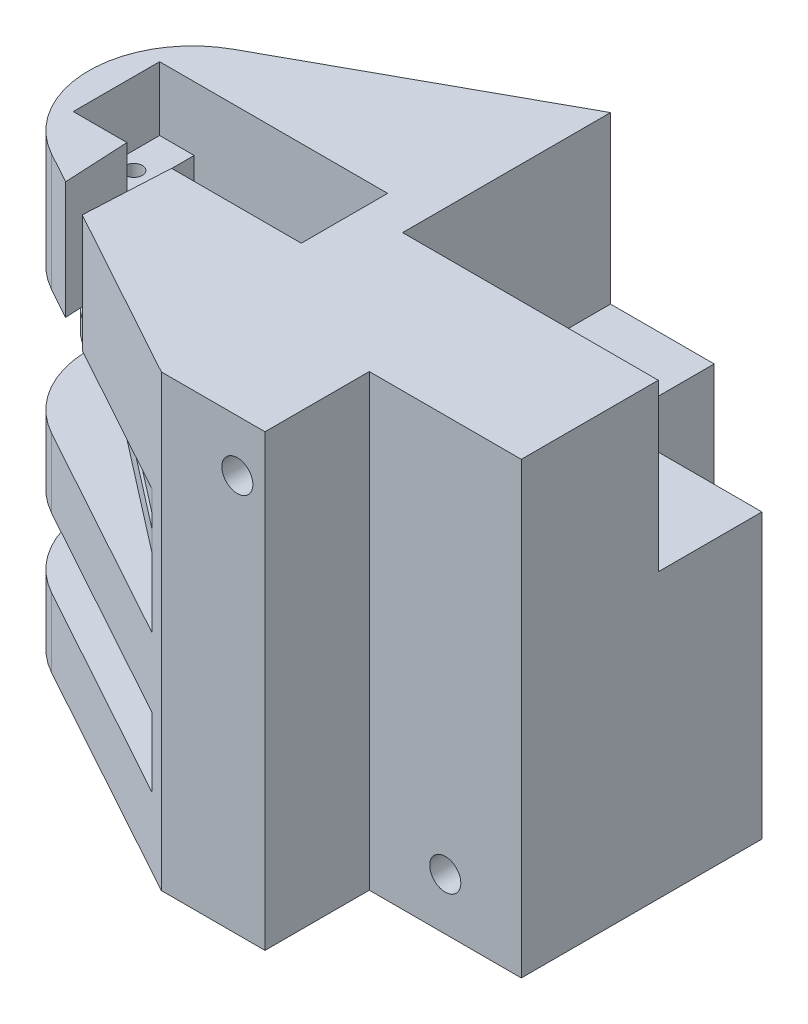
from build123d import *

# Parameters (mm, degrees)
SKETCH1_W               = 80
SKETCH1_H               = 65
BOSS_EXTRUDE1_DEPTH     = 65
SKETCH3_W               = 22
SKETCH3_H               = 15.09
CUT_EXTRUDE1_DEPTH      = 65.72
CUT_EXTRUDE2_DEPTH      = 20
CUT_EXTRUDE2_DEPTH_BACK = 55.72
SKETCH4_R               = 2.245
SKETCH4_R_2             = 2.24505
SKETCH5_W               = 65
SKETCH5_H               = 10
SKETCH5_H_2             = 2
CUT_EXTRUDE3_DEPTH      = 40
CUT_EXTRUDE4_DEPTH      = 65
SKETCH10_R              = 1
CUT_EXTRUDE6_DEPTH      = 42
SKETCH12_R              = 2.9
SKETCH12_R_2            = 6
CUT_EXTRUDE7_DEPTH      = 20
SKETCH14_W              = 23
SKETCH14_H              = 12.5
CUT_EXTRUDE9_DEPTH      = 13.75
SKETCH16_W              = 5
SKETCH16_H              = 12.5
SKETCH16_R              = 1.25
CUT_EXTRUDE10_DEPTH     = 9.25
SKETCH16_4_R            = 1.25
CUT_EXTRUDE11_DEPTH     = 12.5
CUT_EXTRUDE12_DEPTH     = 21.5
CUT_EXTRUDE13_DEPTH     = 8
SKETCH20_R              = 2
BOSS_EXTRUDE2_DEPTH     = 0.5
SKETCH21_R              = 2
BOSS_EXTRUDE3_DEPTH     = 0.5
SKETCH22_R              = 1
CUT_EXTRUDE14_DEPTH     = 30.5
SKETCH23_W              = 37
SKETCH23_H              = 30.09
CUT_EXTRUDE15_DEPTH     = 24


with BuildPart() as part:
    # Sketch1 → Boss-Extrude1 (new body)
    with BuildSketch(Plane.XY):
        with Locations((40, 32.5)):
            Rectangle(SKETCH1_W, SKETCH1_H)
    extrude(amount=BOSS_EXTRUDE1_DEPTH)

    # Sketch3 → Cut-Extrude1 (cut)
    with BuildSketch(Plane.XZ):
        with Locations((69, 57.455)):
            Rectangle(SKETCH3_W, SKETCH3_H)
        with Locations((69, 7.545)):
            Rectangle(SKETCH3_W, SKETCH3_H)
    extrude(amount=-CUT_EXTRUDE1_DEPTH, mode=Mode.SUBTRACT)

    # Sketch4 → Cut-Extrude2 (cut, two sides: drawn at the far end of the back side and taken through both)
    with BuildSketch(Plane.XY.offset(49.91).offset(-CUT_EXTRUDE2_DEPTH_BACK)):
        with Locations(Location((54, 57.5, 0), (0, 0, 180))):
            Circle(SKETCH4_R)
        with Locations(Location((69, 7.5, 0), (0, 0, 180))):
            Circle(SKETCH4_R_2)
    extrude(amount=CUT_EXTRUDE2_DEPTH + CUT_EXTRUDE2_DEPTH_BACK, mode=Mode.SUBTRACT)

    # Sketch5 → Cut-Extrude3 (cut)
    with BuildSketch(Plane.ZY):
        with Locations((32.5, 35)):
            Rectangle(SKETCH5_W, SKETCH5_H)
        with Locations((32.5, 15)):
            Rectangle(SKETCH5_W, SKETCH5_H)
        with Locations((32.5, 44)):
            Rectangle(SKETCH5_W, SKETCH5_H_2)
    extrude(amount=-CUT_EXTRUDE3_DEPTH, mode=Mode.SUBTRACT)

    # Sketch6 → Cut-Extrude4 (cut)
    with BuildSketch(Plane.XZ):
        with BuildLine():
            Line((0, 0), (43, 0))
            Line((43, 0), (7.776682895, 19.353757571))
            ThreePointArc((7.776682895, 19.353757571), (2.089737482, 24.862911437), (0, 32.5))
            Line((0, 32.5), (0, 0))
        make_face()
        with BuildLine():
            Line((0, 65), (0, 32.5))
            ThreePointArc((0, 32.5), (2.089737482, 40.137088563), (7.776682895, 45.646242429))
            Line((7.776682895, 45.646242429), (43, 65))
            Line((43, 65), (0, 65))
        make_face()
    extrude(amount=-CUT_EXTRUDE4_DEPTH, mode=Mode.SUBTRACT)

    # Sketch10 → Cut-Extrude6 (cut)
    with BuildSketch(Plane.XZ):
        with Locations(Location((15, 32.5, 0), (0, 0, 270))):
            Circle(SKETCH10_R)
    extrude(amount=-CUT_EXTRUDE6_DEPTH, mode=Mode.SUBTRACT)

    # Sketch12 → Cut-Extrude7 (cut)
    with BuildSketch(Plane(origin=(0, 65, 0), x_dir=(1, 0, 0), z_dir=(0, 1, 0))):
        with Locations((21.452618395, -32.5)):
            Circle(SKETCH12_R)
        with Locations((15, -32.5)):
            Circle(SKETCH12_R_2)
        with BuildLine():
            Line((21.452618395, -29.6), (20.252618395, -29.6))
            ThreePointArc((20.252618395, -29.6), (20.309467908, -29.705442695), (20.364201004, -29.811999333))
            ThreePointArc((20.364201004, -29.811999333), (20.898182616, -29.653493199), (21.452618395, -29.6))
        make_face()
        with BuildLine():
            ThreePointArc((20.364201004, -35.188000667), (20.309467908, -35.294557305), (20.252618395, -35.4))
            Line((20.252618395, -35.4), (21.452618395, -35.4))
            ThreePointArc((21.452618395, -35.4), (20.898182616, -35.346506801), (20.364201004, -35.188000667))
        make_face()
    extrude(amount=-CUT_EXTRUDE7_DEPTH, mode=Mode.SUBTRACT)

    # Sketch14 → Cut-Extrude9 (cut)
    with BuildSketch(Plane(origin=(0, 65, 0), x_dir=(1, 0, 0), z_dir=(0, 1, 0))):
        with Locations((20.5, -32.5)):
            Rectangle(SKETCH14_W, SKETCH14_H)
    extrude(amount=-CUT_EXTRUDE9_DEPTH, mode=Mode.SUBTRACT)

    # Sketch16 → Cut-Extrude10 (cut)
    # profile 1 of 4: a face of its own
    with BuildSketch(Plane(origin=(0, 65, 0), x_dir=(1, 0, 0), z_dir=(0, 1, 0))):
        with Locations((6.5, -32.5)):
            Rectangle(SKETCH16_W, SKETCH16_H)
        with Locations((6.5, -32.5)):
            Circle(SKETCH16_R, mode=Mode.SUBTRACT)
    # profile 2 of 4: a face of its own
    with BuildSketch(Plane(origin=(0, 65, 0), x_dir=(1, 0, 0), z_dir=(0, 1, 0))):
        with Locations((6.5, -32.5)):
            Circle(SKETCH16_R)
    # profile 3 of 4: a face of its own
    with BuildSketch(Plane(origin=(0, 65, 0), x_dir=(1, 0, 0), z_dir=(0, 1, 0))):
        with Locations((34.5, -32.5)):
            Rectangle(SKETCH16_W, SKETCH16_H)
        with Locations((34.5, -32.5)):
            Circle(SKETCH16_R, mode=Mode.SUBTRACT)
    # profile 4 of 4: a face of its own
    with BuildSketch(Plane(origin=(0, 65, 0), x_dir=(1, 0, 0), z_dir=(0, 1, 0))):
        with Locations((34.5, -32.5)):
            Circle(SKETCH16_R)
    extrude(amount=-CUT_EXTRUDE10_DEPTH, mode=Mode.SUBTRACT)

    # Sketch16<4> → Cut-Extrude11 (cut)
    with BuildSketch(Plane(origin=(0, 65, 0), x_dir=(1, 0, 0), z_dir=(0, 1, 0))):
        with Locations(Location((6.5, -32.5, 0), (0, 0, 270))):
            Circle(SKETCH16_4_R)
        with Locations(Location((34.5, -32.5, 0), (0, 0, 270))):
            Circle(SKETCH16_4_R)
    extrude(amount=-CUT_EXTRUDE11_DEPTH, mode=Mode.SUBTRACT)

    # Sketch18 → Cut-Extrude12 (cut)
    with BuildSketch(Plane(origin=(0, 65, 0), x_dir=(1, 0, 0), z_dir=(0, 1, 0))):
        with BuildLine():
            ThreePointArc((18.531385071, -32.863069526), (15, -36.05), (11.468614929, -32.863069526))
            Line((11.468614929, -32.863069526), (11.770443602, -38.75))
            Line((11.770443602, -38.75), (18.229556398, -38.75))
            Line((18.229556398, -38.75), (18.531385071, -32.863069526))
        make_face()
        with BuildLine():
            Line((15.593717104, -29), (14.406282896, -29))
            ThreePointArc((14.406282896, -29), (12.287971634, -30.209279122), (11.45, -32.5))
            Line((11.45, -32.5), (11.468614929, -32.863069526))
            ThreePointArc((11.468614929, -32.863069526), (15, -36.05), (18.531385071, -32.863069526))
            Line((18.531385071, -32.863069526), (18.55, -32.5))
            ThreePointArc((18.55, -32.5), (17.712028366, -30.209279122), (15.593717104, -29))
        make_face()
        with BuildLine():
            ThreePointArc((15.593717104, -29), (15, -28.95), (14.406282896, -29))
            Line((14.406282896, -29), (15.593717104, -29))
        make_face()
        Polygon((18.229556398, -38.75), (11.770443602, -38.75), (12.25004092, -48.104167856), (17.599264584, -51.043345268), align=None)
    extrude(amount=-CUT_EXTRUDE12_DEPTH, mode=Mode.SUBTRACT)

    # Sketch19 → Cut-Extrude13 (cut)
    with BuildSketch(Plane.XZ.offset(-40)):
        with BuildLine():
            Line((15, 44), (40, 63.351623939))
            Line((40, 63.351623939), (7.776682895, 45.646242429))
            ThreePointArc((7.776682895, 45.646242429), (0, 32.5), (7.776682895, 19.353757571))
            Line((7.776682895, 19.353757571), (40, 1.648376061))
            Line((40, 1.648376061), (15, 21))
            ThreePointArc((15, 21), (3.5, 32.5), (15, 44))
        make_face()
    extrude(amount=-CUT_EXTRUDE13_DEPTH, mode=Mode.SUBTRACT)

    # Sketch20 → Boss-Extrude2 (add)
    with BuildSketch(Plane(origin=(0, 30, 0), x_dir=(1, 0, 0), z_dir=(0, 1, 0))):
        with Locations(Location((15, -32.5, 0), (0, 0, 90))):
            Circle(SKETCH20_R)
    extrude(amount=BOSS_EXTRUDE2_DEPTH)

    # Sketch21 → Boss-Extrude3 (add)
    with BuildSketch(Plane(origin=(0, 10, 0), x_dir=(1, 0, 0), z_dir=(0, 1, 0))):
        with Locations(Location((15, -32.5, 0), (0, 0, 90))):
            Circle(SKETCH21_R)
    extrude(amount=BOSS_EXTRUDE3_DEPTH)

    # Sketch22 → Cut-Extrude14 (cut)
    with BuildSketch(Plane.XZ):
        with Locations(Location((15, 32.5, 0), (0, 0, 270))):
            Circle(SKETCH22_R)
    extrude(amount=-CUT_EXTRUDE14_DEPTH, mode=Mode.SUBTRACT)

    # Sketch23 → Cut-Extrude15 (cut)
    with BuildSketch(Plane(origin=(0, 65, 0), x_dir=(1, 0, 0), z_dir=(0, 1, 0))):
        with Locations((61.5, -15.045)):
            Rectangle(SKETCH23_W, SKETCH23_H)
    extrude(amount=-CUT_EXTRUDE15_DEPTH, mode=Mode.SUBTRACT)


solid = part.part
